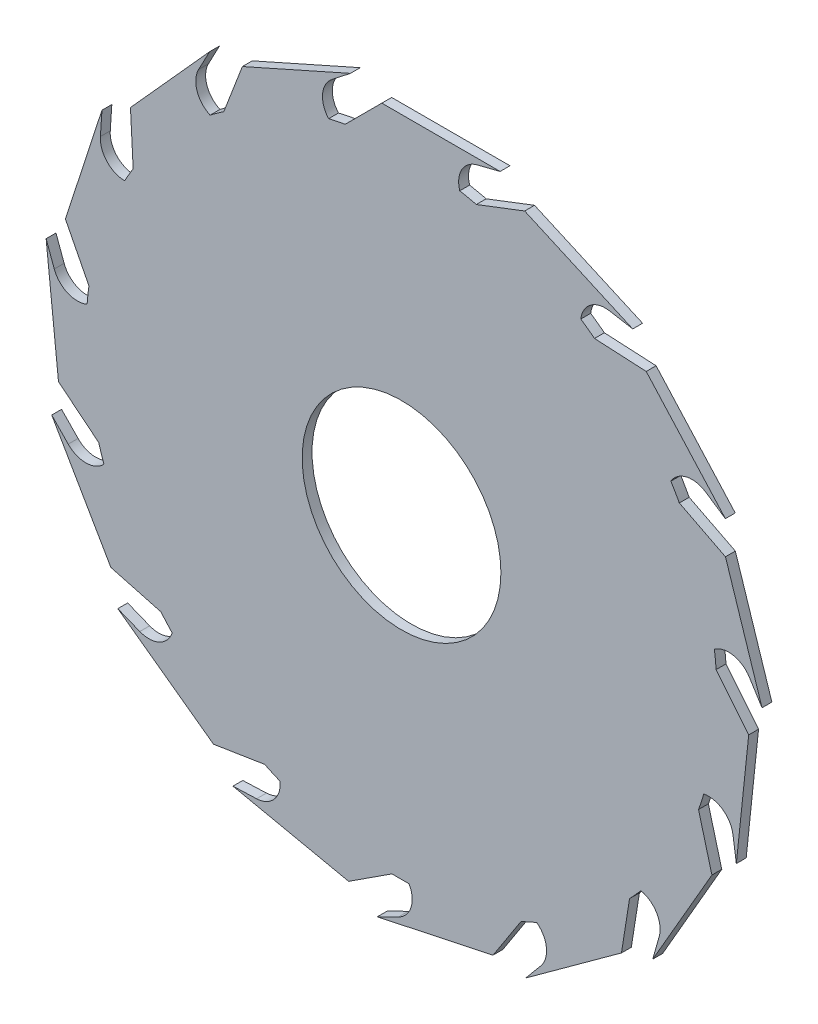
from build123d import *

# Parameters (mm, degrees)
SKETCH1_R           = 50.8
BOSS_EXTRUDE1_DEPTH = 1.5875
CUT_EXTRUDE1_REACH  = 73.86
SKETCH2_R           = 16.002
BOSS_EXTRUDE2_DEPTH = 1.5875
CIRPATTERN1_COUNT   = 15


with BuildPart() as part:
    # Sketch1 → Boss-Extrude1 (new body)
    with BuildSketch(Plane.XY):
        Circle(SKETCH1_R)
    extrude(amount=BOSS_EXTRUDE1_DEPTH)

    # Sketch2 → Cut-Extrude1 (cut, up to next)
    with BuildSketch(Plane.XY.offset(1.5875), mode=Mode.PRIVATE) as cut_extrude1_sk1:
        Circle(SKETCH2_R)
    cut_extrude1_tool1 = extrude(cut_extrude1_sk1.sketch, amount=-CUT_EXTRUDE1_REACH, mode=Mode.PRIVATE) & part.part
    add(cut_extrude1_tool1.solids().sort_by_distance((0, 0, 1.5875))[0], mode=Mode.SUBTRACT)

    # Sketch4 → Boss-Extrude2 (add)
    with BuildSketch(Plane.XY.offset(1.5875)):
        with BuildLine():
            Line((-9.525, 49.53), (-3.175, 55.88))
            Line((-3.175, 55.88), (15.875, 55.88))
            Line((15.875, 55.88), (12.1812879, 54.945874246))
            ThreePointArc((12.1812879, 54.945874246), (9.599565558, 52.852771398), (9.525, 49.53))
            Line((9.525, 49.53), (-9.525, 49.53))
        make_face()
    boss_extrude2 = extrude(amount=-BOSS_EXTRUDE2_DEPTH)

    # CirPattern1: Boss-Extrude2 ×15 about axis
    cirpattern1_axis = Axis((0, 0, 0), (0, 0, 1))
    for i in range(1, CIRPATTERN1_COUNT):
        add(boss_extrude2.rotate(cirpattern1_axis, i * 360 / CIRPATTERN1_COUNT))


solid = part.part
